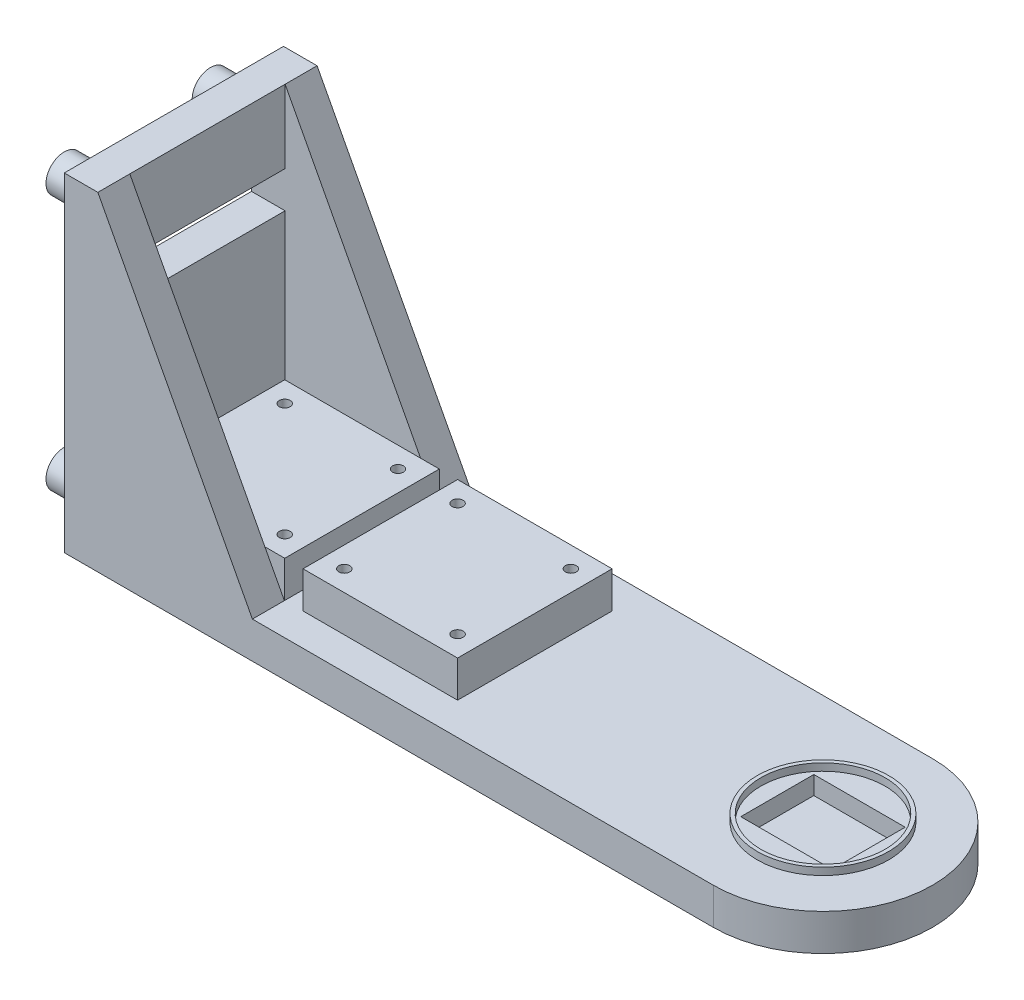
from build123d import *

# Parameters (mm, degrees)
SKETCH2_R           = 1.5
BOSS_EXTRUDE1_DEPTH = 10
SKETCH3_W           = 25
SKETCH3_H           = 20
CUT_EXTRUDE1_DEPTH  = 5
SKETCH5_R           = 18
SKETCH5_R_2         = 17
BOSS_EXTRUDE2_DEPTH = 2
SKETCH2_3_W         = 42.3
SKETCH2_3_H         = 42.3
SKETCH2_3_R         = 1.5
BOSS_EXTRUDE3_DEPTH = 20
SKETCH8_W           = 40
SKETCH8_H           = 60
BOSS_EXTRUDE4_DEPTH = 10
SKETCH9_W           = 42.3
SKETCH9_H           = 42.3
SKETCH9_R           = 1.5
BOSS_EXTRUDE5_DEPTH = 10
CUT_EXTRUDE3_START  = -10
SKETCH9_3_R         = 1.5
CUT_EXTRUDE3_DEPTH  = 10
SKETCH10_W          = 9.18782392
SKETCH10_H          = 60
BOSS_EXTRUDE6_DEPTH = 80
BOSS_EXTRUDE7_DEPTH = 8.75
BOSS_EXTRUDE9_DEPTH = 10
SKETCH16_W          = 42.5
SKETCH16_H          = 10
CUT_EXTRUDE5_DEPTH  = 9.18782392


with BuildPart() as part:
    # Sketch2 → Boss-Extrude1 (new body)
    with BuildSketch(Plane(origin=(0, 0, 0), x_dir=(1, 0, 0), z_dir=(0, 1, 0))):
        with BuildLine():
            Line((-37.63782392, -30), (100, -30))
            ThreePointArc((100, -30), (130, 0), (100, 30))
            Line((100, 30), (-37.63782392, 30))
            Line((-37.63782392, 30), (-37.63782392, -30))
        make_face()
        with Locations(Location((-15.5, 15.5, 0), (0, 0, 270))):
            Circle(SKETCH2_R, mode=Mode.SUBTRACT)
        with Locations(Location((15.5, -15.5, 0), (0, 0, 270))):
            Circle(SKETCH2_R, mode=Mode.SUBTRACT)
        with Locations(Location((-15.5, -15.5, 0), (0, 0, 270))):
            Circle(SKETCH2_R, mode=Mode.SUBTRACT)
        with Locations(Location((15.5, 15.5, 0), (0, 0, 270))):
            Circle(SKETCH2_R, mode=Mode.SUBTRACT)
    extrude(amount=BOSS_EXTRUDE1_DEPTH)

    # Sketch3 → Cut-Extrude1 (cut)
    with BuildSketch(Plane(origin=(0, 10, 0), x_dir=(1, 0, 0), z_dir=(0, 1, 0))):
        with Locations((100, 0)):
            Rectangle(SKETCH3_W, SKETCH3_H)
    extrude(amount=-CUT_EXTRUDE1_DEPTH, mode=Mode.SUBTRACT)

    # Sketch5 → Boss-Extrude2 (add)
    with BuildSketch(Plane(origin=(0, 10, 0), x_dir=(1, 0, 0), z_dir=(0, 1, 0))):
        with Locations(Location((100, 0, 0), (0, 0, 270))):
            Circle(SKETCH5_R)
        with Locations(Location((100, 0, 0), (0, 0, 270))):
            Circle(SKETCH5_R_2, mode=Mode.SUBTRACT)
    extrude(amount=BOSS_EXTRUDE2_DEPTH)

    # Sketch2<3> → Boss-Extrude3 (add)
    with BuildSketch(Plane(origin=(0, 0, 0), x_dir=(1, 0, 0), z_dir=(0, 1, 0))):
        Rectangle(SKETCH2_3_W, SKETCH2_3_H)
        with Locations(Location((-15.5, -15.5, 0), (0, 0, 270))):
            Circle(SKETCH2_3_R, mode=Mode.SUBTRACT)
        with Locations(Location((15.5, -15.5, 0), (0, 0, 270))):
            Circle(SKETCH2_3_R, mode=Mode.SUBTRACT)
        with Locations(Location((15.5, 15.5, 0), (0, 0, 270))):
            Circle(SKETCH2_3_R, mode=Mode.SUBTRACT)
        with Locations(Location((-15.5, 15.5, 0), (0, 0, 270))):
            Circle(SKETCH2_3_R, mode=Mode.SUBTRACT)
    extrude(amount=BOSS_EXTRUDE3_DEPTH)

    # Sketch8 → Boss-Extrude4 (add)
    with BuildSketch(Plane.XZ):
        with Locations((-57.63782392, 0)):
            Rectangle(SKETCH8_W, SKETCH8_H)
    extrude(amount=-BOSS_EXTRUDE4_DEPTH)

    # Sketch9 → Boss-Extrude5 (add)
    with BuildSketch(Plane(origin=(0, 10, 0), x_dir=(1, 0, 0), z_dir=(0, 1, 0))):
        with Locations((-47.3, 0)):
            Rectangle(SKETCH9_W, SKETCH9_H)
        with Locations(Location((-31.8, 15.5, 0), (0, 0, 270))):
            Circle(SKETCH9_R, mode=Mode.SUBTRACT)
        with Locations(Location((-31.8, -15.5, 0), (0, 0, 270))):
            Circle(SKETCH9_R, mode=Mode.SUBTRACT)
        with Locations(Location((-62.8, -15.5, 0), (0, 0, 270))):
            Circle(SKETCH9_R, mode=Mode.SUBTRACT)
        with Locations(Location((-62.8, 15.5, 0), (0, 0, 270))):
            Circle(SKETCH9_R, mode=Mode.SUBTRACT)
    extrude(amount=BOSS_EXTRUDE5_DEPTH)

    # Sketch9<3> → Cut-Extrude3 (cut)
    with BuildSketch(Plane(origin=(0, 10, 0), x_dir=(1, 0, 0), z_dir=(0, 1, 0)).offset(CUT_EXTRUDE3_START)):
        with Locations(Location((-62.8, -15.5, 0), (0, 0, 270))):
            Circle(SKETCH9_3_R)
        with Locations(Location((-31.8, -15.5, 0), (0, 0, 270))):
            Circle(SKETCH9_3_R)
        with Locations(Location((-31.8, 15.5, 0), (0, 0, 270))):
            Circle(SKETCH9_3_R)
        with Locations(Location((-62.8, 15.5, 0), (0, 0, 270))):
            Circle(SKETCH9_3_R)
    extrude(amount=CUT_EXTRUDE3_DEPTH, mode=Mode.SUBTRACT)

    # Sketch10 → Boss-Extrude6 (add)
    with BuildSketch(Plane(origin=(0, 10, 0), x_dir=(1, 0, 0), z_dir=(0, 1, 0))):
        with Locations((-73.04391196, 0)):
            Rectangle(SKETCH10_W, SKETCH10_H)
    extrude(amount=BOSS_EXTRUDE6_DEPTH)

    # Sketch13 → Boss-Extrude7 (add)
    with BuildSketch(Plane.XY.offset(30)):
        Polygon((-68.45, 90), (-26.15, 10), (-68.45, 10), align=None)
    boss_extrude7 = extrude(amount=-BOSS_EXTRUDE7_DEPTH)

    # Mirror2: Boss-Extrude7 across plane
    add(boss_extrude7.mirror(Plane.XY))

    # Sketch11 → Boss-Extrude9 (add)
    with BuildSketch(Plane.ZY.offset(77.63782392)):
        with BuildLine():
            ThreePointArc((-15, 80), (-23.535533906, 83.535533906), (-20, 75))
            Line((-20, 75), (-20, 80))
            Line((-20, 80), (-15, 80))
        make_face()
        with BuildLine():
            Line((-20, 80), (-20, 75))
            ThreePointArc((-20, 75), (-16.464466094, 76.464466094), (-15, 80))
            Line((-15, 80), (-20, 80))
        make_face()
        with BuildLine():
            ThreePointArc((15, 80), (16.464466094, 76.464466094), (20, 75))
            Line((20, 75), (20, 80))
            Line((20, 80), (15, 80))
        make_face()
        with BuildLine():
            Line((20, 80), (20, 75))
            ThreePointArc((20, 75), (23.535533906, 76.464466094), (25, 80))
            ThreePointArc((25, 80), (20, 85), (15, 80))
            Line((15, 80), (20, 80))
        make_face()
        with BuildLine():
            ThreePointArc((20, 15), (16.464466094, 13.535533906), (15, 10))
            Line((15, 10), (20, 10))
            Line((20, 10), (20, 15))
        make_face()
        with BuildLine():
            Line((20, 10), (15, 10))
            ThreePointArc((15, 10), (20, 5), (25, 10))
            ThreePointArc((25, 10), (23.535533906, 13.535533906), (20, 15))
            Line((20, 15), (20, 10))
        make_face()
        with BuildLine():
            Line((-20, 15), (-20, 10))
            Line((-20, 10), (-15, 10))
            ThreePointArc((-15, 10), (-16.464466094, 13.535533906), (-20, 15))
        make_face()
        with BuildLine():
            Line((-15, 10), (-20, 10))
            Line((-20, 10), (-20, 15))
            ThreePointArc((-20, 15), (-23.535533906, 6.464466094), (-15, 10))
        make_face()
    extrude(amount=BOSS_EXTRUDE9_DEPTH)

    # Sketch16 → Cut-Extrude5 (cut)
    with BuildSketch(Plane(origin=(-68.45, 0, 0), x_dir=(0, 0, -1), z_dir=(1, 0, 0))):
        with Locations((0, 65)):
            Rectangle(SKETCH16_W, SKETCH16_H)
    extrude(amount=-CUT_EXTRUDE5_DEPTH, mode=Mode.SUBTRACT)


solid = part.part
